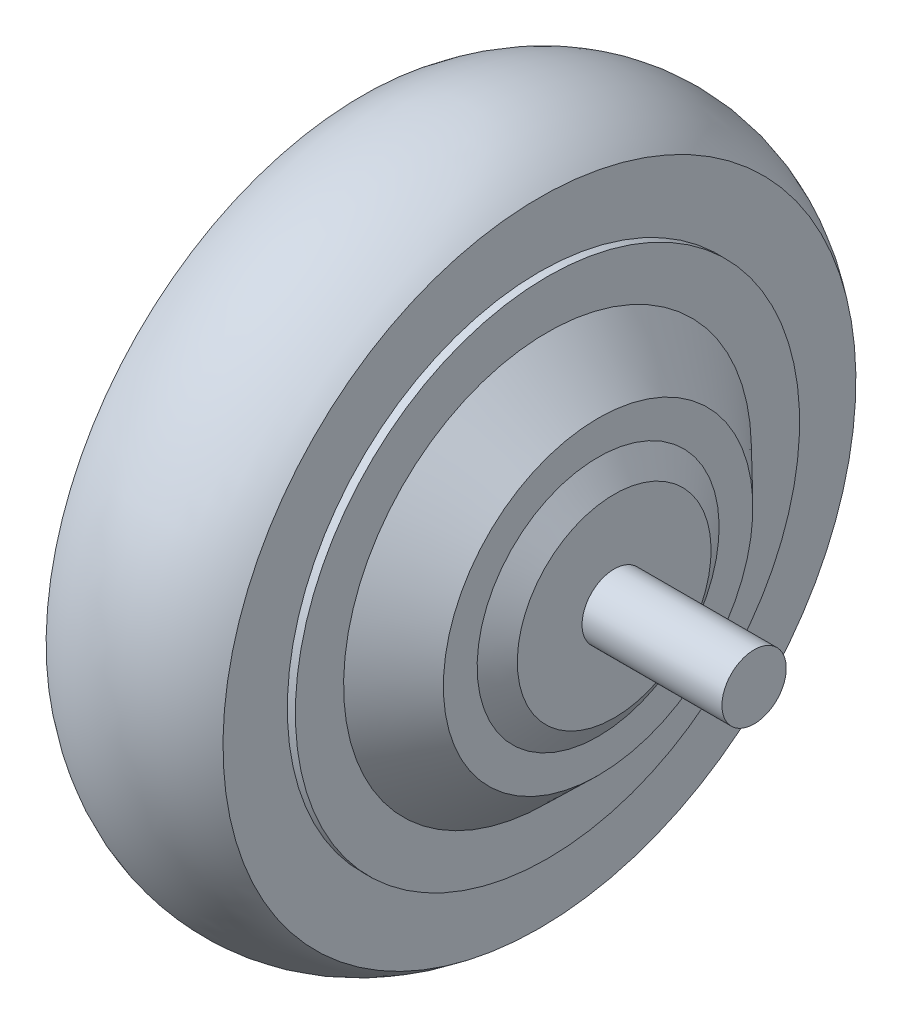
from build123d import *


with BuildPart() as part:
    # Croquis1 → Revolución1 (revolve)
    with BuildSketch(Plane.XY, mode=Mode.PRIVATE) as revoluci_n1_sk:
        with BuildLine():
            Line((-22, 165.221315178), (-22, 149.221315178))
            Line((-22, 149.221315178), (-24, 149.221315178))
            Line((-24, 149.221315178), (-24, 137.221315178))
            Line((-24, 137.221315178), (-34.6, 125))
            Line((-34.6, 125), (-34.6, 86.5))
            Line((-34.6, 86.5), (75.4, 86.5))
            Line((75.4, 86.5), (75.4, 94.5))
            Line((75.4, 94.5), (40.6, 94.5))
            Line((40.6, 94.5), (40.6, 110.6))
            Line((40.6, 110.6), (36.6, 116.6))
            Line((36.6, 116.6), (36.6, 125))
            Line((36.6, 125), (24, 137.221315178))
            Line((24, 137.221315178), (24, 149.221315178))
            Line((24, 149.221315178), (22, 149.221315178))
            Line((22, 149.221315178), (22, 165.221315178))
            ThreePointArc((22, 165.221315178), (0, 173), (-22, 165.221315178))
        make_face()
    revolve(revoluci_n1_sk.sketch.rotate(Axis((-34.6, 86.5, 0), (1, 0, 0)), 180), axis=Axis((-34.6, 86.5, 0), (1, 0, 0)))


solid = part.part
